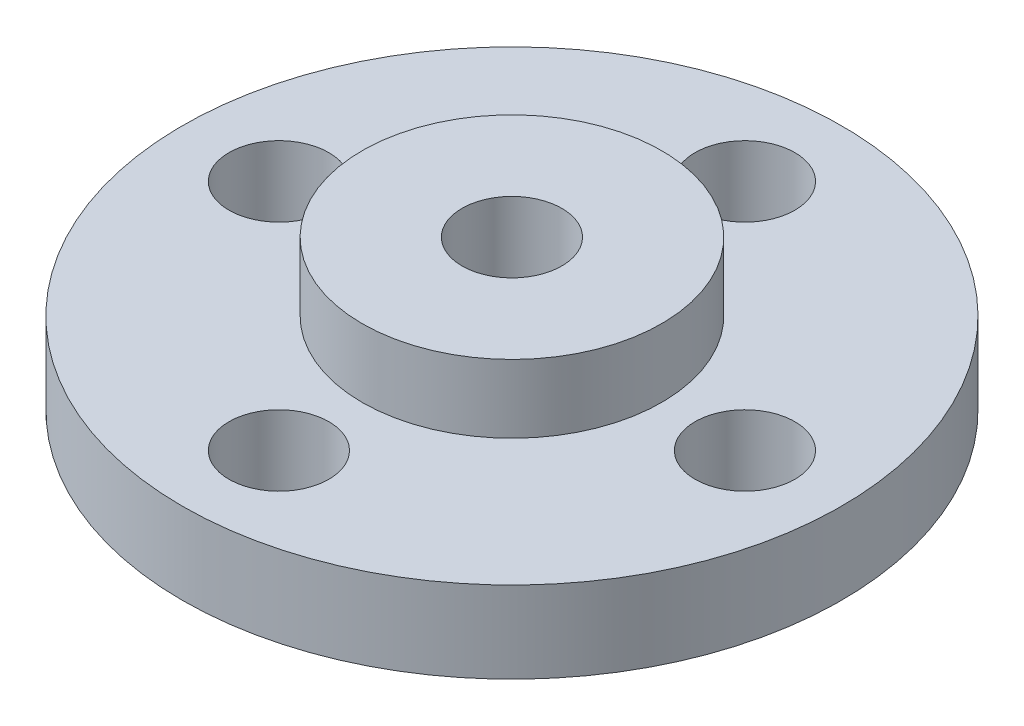
from build123d import *

# Parameters (mm, degrees)
SKETCH2_R           = 9.9
BOSS_EXTRUDE2_DEPTH = 2.45
SKETCH3_R           = 4.5
SKETCH3_R_2         = 1.5
BOSS_EXTRUDE3_DEPTH = 2.05
SKETCH5_R           = 1.5
CUT_EXTRUDE1_DEPTH  = 15.213461929
SKETCH6_R           = 1.5
CUT_EXTRUDE2_DEPTH  = 15.213461929
CIRPATTERN1_COUNT   = 4


with BuildPart() as part:
    # Sketch2 → Boss-Extrude2 (new body)
    with BuildSketch(Plane(origin=(0, 0, 0), x_dir=(1, 0, 0), z_dir=(0, 1, 0))):
        Circle(SKETCH2_R)
    extrude(amount=BOSS_EXTRUDE2_DEPTH)

    # Sketch3 → Boss-Extrude3 (add)
    with BuildSketch(Plane(origin=(0, 2.45, 0), x_dir=(1, 0, 0), z_dir=(0, 1, 0))):
        Circle(SKETCH3_R)
        Circle(SKETCH3_R_2, mode=Mode.SUBTRACT)
    extrude(amount=BOSS_EXTRUDE3_DEPTH)

    # Sketch5 → Cut-Extrude1 (cut, through all)
    with BuildSketch(Plane(origin=(0, 2.45, 0), x_dir=(1, 0, 0), z_dir=(0, 1, 0))):
        Circle(SKETCH5_R)
    extrude(amount=-CUT_EXTRUDE1_DEPTH, mode=Mode.SUBTRACT)

    # Sketch6 → Cut-Extrude2 (cut, through all)
    with BuildSketch(Plane(origin=(0, 2.45, 0), x_dir=(1, 0, 0), z_dir=(0, 1, 0))):
        with Locations((7, 0)):
            Circle(SKETCH6_R)
    cut_extrude2 = extrude(amount=-CUT_EXTRUDE2_DEPTH, mode=Mode.SUBTRACT)

    # CirPattern1: Cut-Extrude2 ×4 about axis
    cirpattern1_axis = Axis((0, 4.5, 0), (0, -1, 0))
    for i in range(1, CIRPATTERN1_COUNT):
        add(cut_extrude2.rotate(cirpattern1_axis, i * 360 / CIRPATTERN1_COUNT), mode=Mode.SUBTRACT)


solid = part.part
